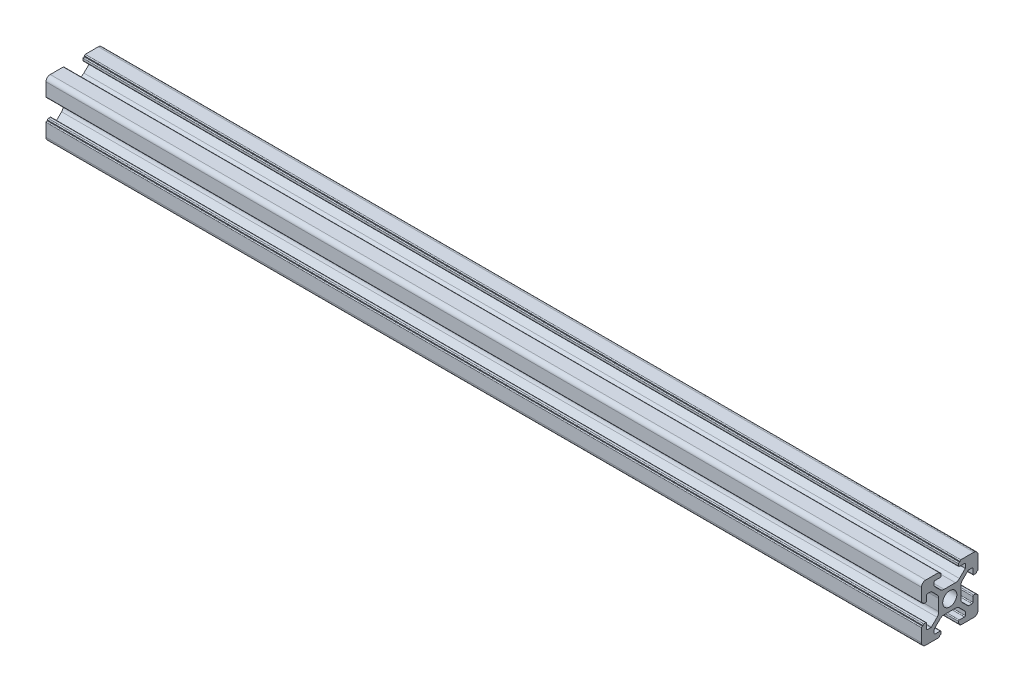
from build123d import *

# Parameters (mm, degrees)
SKETCH_11_R         = 2.5
MEMBER_2020_1_DEPTH = 310


with BuildPart() as part:
    # 草图11 → Member 2020_1 (new body)
    with BuildSketch(Plane(origin=(-129.166666667, 49.155092593, 0), x_dir=(0, 1, 0), z_dir=(1, 0, 0))):
        with BuildLine():
            Line((3.9, 0), (3.9, -2.010912703))
            ThreePointArc((3.9, -2.010912703), (4.052240935, -2.776279568), (4.485786438, -3.425126266))
            Line((4.485786438, -3.425126266), (6.560660172, -5.5))
            Line((6.560660172, -5.5), (7.9, -5.5))
            ThreePointArc((7.9, -5.5), (8.112132034, -5.412132034), (8.2, -5.2))
            Line((8.2, -5.2), (8.2, -3.4))
            ThreePointArc((8.2, -3.4), (8.287867966, -3.187867966), (8.5, -3.1))
            Line((8.5, -3.1), (9.2, -3.1))
            ThreePointArc((9.2, -3.1), (9.412132034, -3.187867966), (9.5, -3.4))
            Line((9.5, -3.4), (9.5, -3.6))
            Line((9.5, -3.6), (9.7, -3.6))
            ThreePointArc((9.7, -3.6), (9.912132034, -3.687867966), (10, -3.9))
            Line((10, -3.9), (10, -8.5))
            ThreePointArc((10, -8.5), (9.560660172, -9.560660172), (8.5, -10))
            Line((8.5, -10), (3.9, -10))
            ThreePointArc((3.9, -10), (3.687867966, -9.912132034), (3.6, -9.7))
            ThreePointArc((3.6, -9.7), (3.541421356, -9.558578644), (3.4, -9.5))
            ThreePointArc((3.4, -9.5), (3.187867966, -9.412132034), (3.1, -9.2))
            Line((3.1, -9.2), (3.1, -8.5))
            ThreePointArc((3.1, -8.5), (3.187867966, -8.287867966), (3.4, -8.2))
            Line((3.4, -8.2), (5.2, -8.2))
            ThreePointArc((5.2, -8.2), (5.412132034, -8.112132034), (5.5, -7.9))
            Line((5.5, -7.9), (5.5, -6.68492424))
            ThreePointArc((5.5, -6.68492424), (5.47716386, -6.570119211), (5.412132034, -6.472792206))
            Line((5.412132034, -6.472792206), (3.425126266, -4.485786438))
            ThreePointArc((3.425126266, -4.485786438), (2.776279568, -4.052240935), (2.010912703, -3.9))
            Line((2.010912703, -3.9), (0, -3.9))
            Line((0, -3.9), (-2.010912703, -3.9))
            ThreePointArc((-2.010912703, -3.9), (-2.776279568, -4.052240935), (-3.425126266, -4.485786438))
            Line((-3.425126266, -4.485786438), (-5.412132034, -6.472792206))
            ThreePointArc((-5.412132034, -6.472792206), (-5.47716386, -6.570119211), (-5.5, -6.68492424))
            Line((-5.5, -6.68492424), (-5.5, -7.9))
            ThreePointArc((-5.5, -7.9), (-5.412132034, -8.112132034), (-5.2, -8.2))
            Line((-5.2, -8.2), (-3.4, -8.2))
            ThreePointArc((-3.4, -8.2), (-3.187867966, -8.287867966), (-3.1, -8.5))
            Line((-3.1, -8.5), (-3.1, -9.2))
            ThreePointArc((-3.1, -9.2), (-3.187867966, -9.412132034), (-3.4, -9.5))
            ThreePointArc((-3.4, -9.5), (-3.541421356, -9.558578644), (-3.6, -9.7))
            ThreePointArc((-3.6, -9.7), (-3.687867966, -9.912132034), (-3.9, -10))
            Line((-3.9, -10), (-8.5, -10))
            ThreePointArc((-8.5, -10), (-9.560660172, -9.560660172), (-10, -8.5))
            Line((-10, -8.5), (-10, -3.9))
            ThreePointArc((-10, -3.9), (-9.912132034, -3.687867966), (-9.7, -3.6))
            Line((-9.7, -3.6), (-9.5, -3.6))
            Line((-9.5, -3.6), (-9.5, -3.4))
            ThreePointArc((-9.5, -3.4), (-9.412132034, -3.187867966), (-9.2, -3.1))
            Line((-9.2, -3.1), (-8.5, -3.1))
            ThreePointArc((-8.5, -3.1), (-8.287867965, -3.187867966), (-8.2, -3.4))
            Line((-8.2, -3.4), (-8.2, -5.2))
            ThreePointArc((-8.2, -5.2), (-8.112132034, -5.412132034), (-7.9, -5.5))
            Line((-7.9, -5.5), (-6.68492424, -5.5))
            ThreePointArc((-6.68492424, -5.5), (-6.570119211, -5.47716386), (-6.472792206, -5.412132034))
            Line((-6.472792206, -5.412132034), (-4.485786438, -3.425126266))
            ThreePointArc((-4.485786438, -3.425126266), (-4.052240935, -2.776279568), (-3.9, -2.010912703))
            Line((-3.9, -2.010912703), (-3.9, 0))
            Line((-3.9, 0), (-3.9, 2.010912703))
            ThreePointArc((-3.9, 2.010912703), (-4.052240935, 2.776279568), (-4.485786438, 3.425126266))
            Line((-4.485786438, 3.425126266), (-6.472792206, 5.412132034))
            ThreePointArc((-6.472792206, 5.412132034), (-6.570119211, 5.47716386), (-6.68492424, 5.5))
            Line((-6.68492424, 5.5), (-7.9, 5.5))
            ThreePointArc((-7.9, 5.5), (-8.112132034, 5.412132034), (-8.2, 5.2))
            Line((-8.2, 5.2), (-8.2, 3.4))
            ThreePointArc((-8.2, 3.4), (-8.287867965, 3.187867966), (-8.5, 3.1))
            Line((-8.5, 3.1), (-9.2, 3.1))
            ThreePointArc((-9.2, 3.1), (-9.412132034, 3.187867966), (-9.5, 3.4))
            Line((-9.5, 3.4), (-9.5, 3.6))
            Line((-9.5, 3.6), (-9.7, 3.6))
            ThreePointArc((-9.7, 3.6), (-9.912132034, 3.687867966), (-10, 3.9))
            Line((-10, 3.9), (-10, 8.5))
            ThreePointArc((-10, 8.5), (-9.560660172, 9.560660172), (-8.5, 10))
            Line((-8.5, 10), (-3.9, 10))
            ThreePointArc((-3.9, 10), (-3.687867966, 9.912132034), (-3.6, 9.7))
            Line((-3.6, 9.7), (-3.6, 9.5))
            Line((-3.6, 9.5), (-3.4, 9.5))
            ThreePointArc((-3.4, 9.5), (-3.187867966, 9.412132034), (-3.1, 9.2))
            Line((-3.1, 9.2), (-3.1, 8.5))
            ThreePointArc((-3.1, 8.5), (-3.187867966, 8.287867966), (-3.4, 8.2))
            Line((-3.4, 8.2), (-5.2, 8.2))
            ThreePointArc((-5.2, 8.2), (-5.412132034, 8.112132034), (-5.5, 7.9))
            Line((-5.5, 7.9), (-5.5, 6.68492424))
            ThreePointArc((-5.5, 6.68492424), (-5.47716386, 6.570119211), (-5.412132034, 6.472792206))
            Line((-5.412132034, 6.472792206), (-3.425126266, 4.485786438))
            ThreePointArc((-3.425126266, 4.485786438), (-2.776279568, 4.052240935), (-2.010912703, 3.9))
            Line((-2.010912703, 3.9), (0, 3.9))
            Line((0, 3.9), (2.010912703, 3.9))
            ThreePointArc((2.010912703, 3.9), (2.776279568, 4.052240935), (3.425126266, 4.485786438))
            Line((3.425126266, 4.485786438), (5.412132034, 6.472792206))
            ThreePointArc((5.412132034, 6.472792206), (5.47716386, 6.570119211), (5.5, 6.68492424))
            Line((5.5, 6.68492424), (5.5, 7.9))
            ThreePointArc((5.5, 7.9), (5.412132034, 8.112132034), (5.2, 8.2))
            Line((5.2, 8.2), (3.4, 8.2))
            ThreePointArc((3.4, 8.2), (3.187867966, 8.287867966), (3.1, 8.5))
            Line((3.1, 8.5), (3.1, 9.2))
            ThreePointArc((3.1, 9.2), (3.187867966, 9.412132034), (3.4, 9.5))
            Line((3.4, 9.5), (3.6, 9.5))
            Line((3.6, 9.5), (3.6, 9.7))
            ThreePointArc((3.6, 9.7), (3.687867966, 9.912132034), (3.9, 10))
            Line((3.9, 10), (8.5, 10))
            ThreePointArc((8.5, 10), (9.560660172, 9.560660172), (10, 8.5))
            Line((10, 8.5), (10, 3.9))
            ThreePointArc((10, 3.9), (9.912132034, 3.687867966), (9.7, 3.6))
            Line((9.7, 3.6), (9.5, 3.6))
            Line((9.5, 3.6), (9.5, 3.4))
            ThreePointArc((9.5, 3.4), (9.412132034, 3.187867966), (9.2, 3.1))
            Line((9.2, 3.1), (8.5, 3.1))
            ThreePointArc((8.5, 3.1), (8.287867966, 3.187867966), (8.2, 3.4))
            Line((8.2, 3.4), (8.2, 5.2))
            ThreePointArc((8.2, 5.2), (8.112132034, 5.412132034), (7.9, 5.5))
            Line((7.9, 5.5), (6.68492424, 5.5))
            ThreePointArc((6.68492424, 5.5), (6.570119211, 5.47716386), (6.472792206, 5.412132034))
            Line((6.472792206, 5.412132034), (4.485786438, 3.425126266))
            ThreePointArc((4.485786438, 3.425126266), (4.052240935, 2.776279568), (3.9, 2.010912703))
            Line((3.9, 2.010912703), (3.9, 0))
        make_face()
        Circle(SKETCH_11_R, mode=Mode.SUBTRACT)
    extrude(amount=MEMBER_2020_1_DEPTH)


solid = part.part
